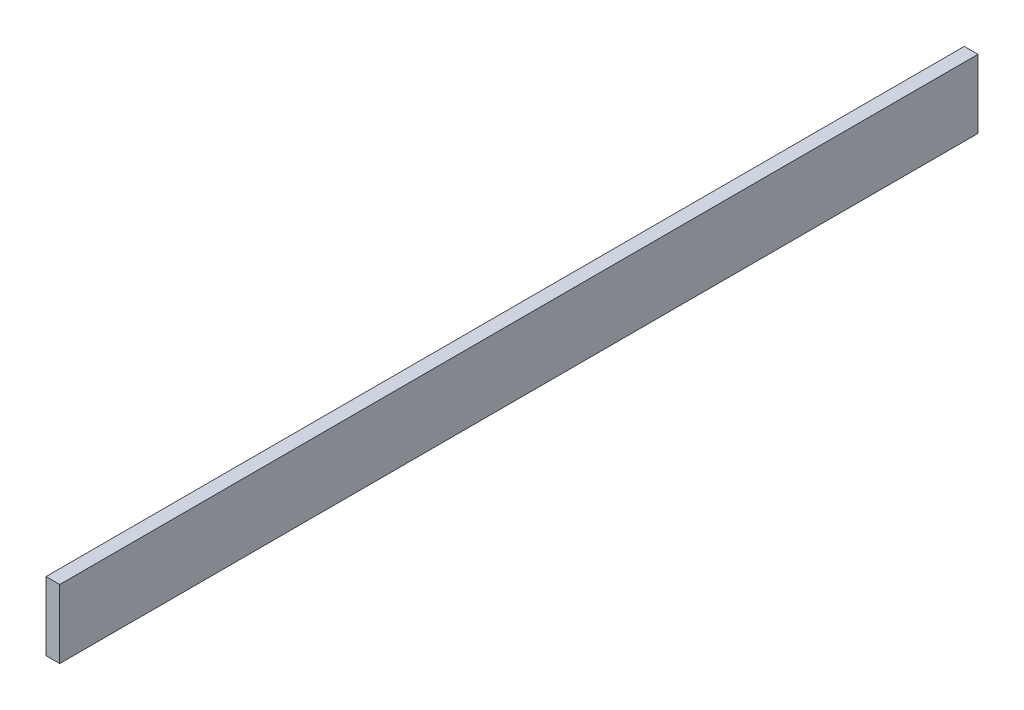
from build123d import *

# Parameters (mm, degrees)
EXTRUDE_1_DEPTH = 10


with BuildPart() as part:
    # 草图1 → 凸台-拉伸1 (new body)
    with BuildSketch(Plane(origin=(0, 0, 0), x_dir=(1, 0, 0), z_dir=(0, 1, 0))):
        Polygon((12, -132), (12, 2), (10, 2), (10, 0), (10, -130), (10, -132), align=None)
    extrude(amount=EXTRUDE_1_DEPTH)


solid = part.part
